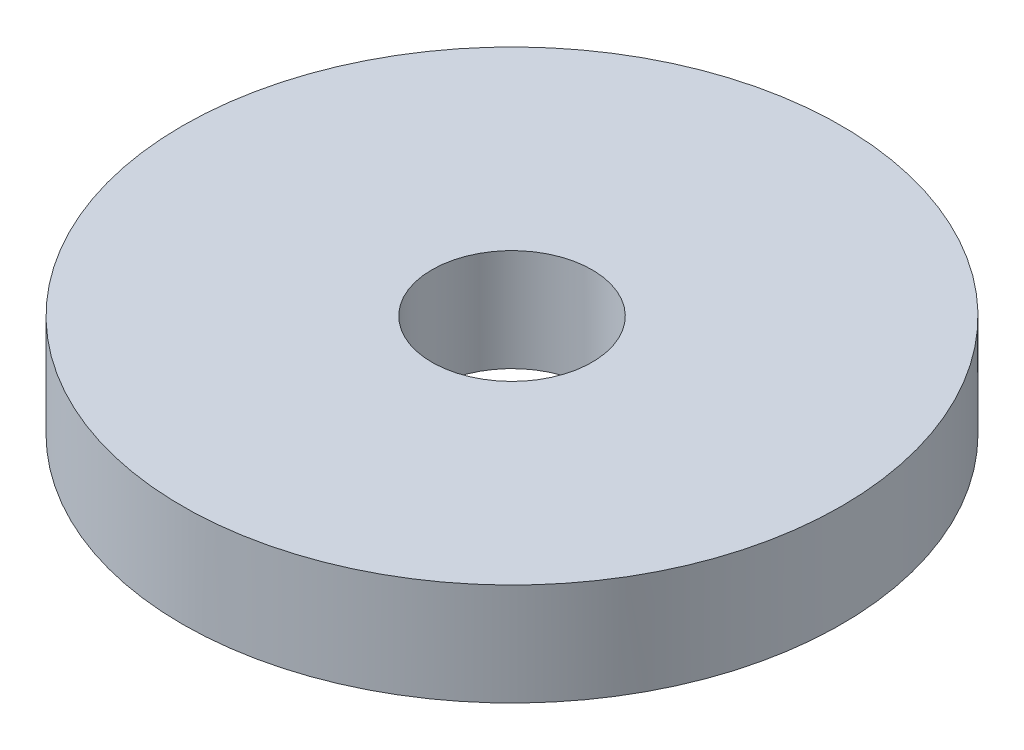
from build123d import *

# Parameters (mm, degrees)
SKETCH1_R           = 10.075
SKETCH1_R_2         = 2.45
BOSS_EXTRUDE1_DEPTH = 3.125


with BuildPart() as part:
    # Sketch1 → Boss-Extrude1 (new body)
    with BuildSketch(Plane(origin=(0, 0, 0), x_dir=(1, 0, 0), z_dir=(0, 1, 0))):
        with Locations(Location((0, 0, 0), (0, 0, 180))):
            Circle(SKETCH1_R)
        with Locations(Location((0, 0, 0), (0, 0, 180))):
            Circle(SKETCH1_R_2, mode=Mode.SUBTRACT)
    extrude(amount=BOSS_EXTRUDE1_DEPTH)


solid = part.part
